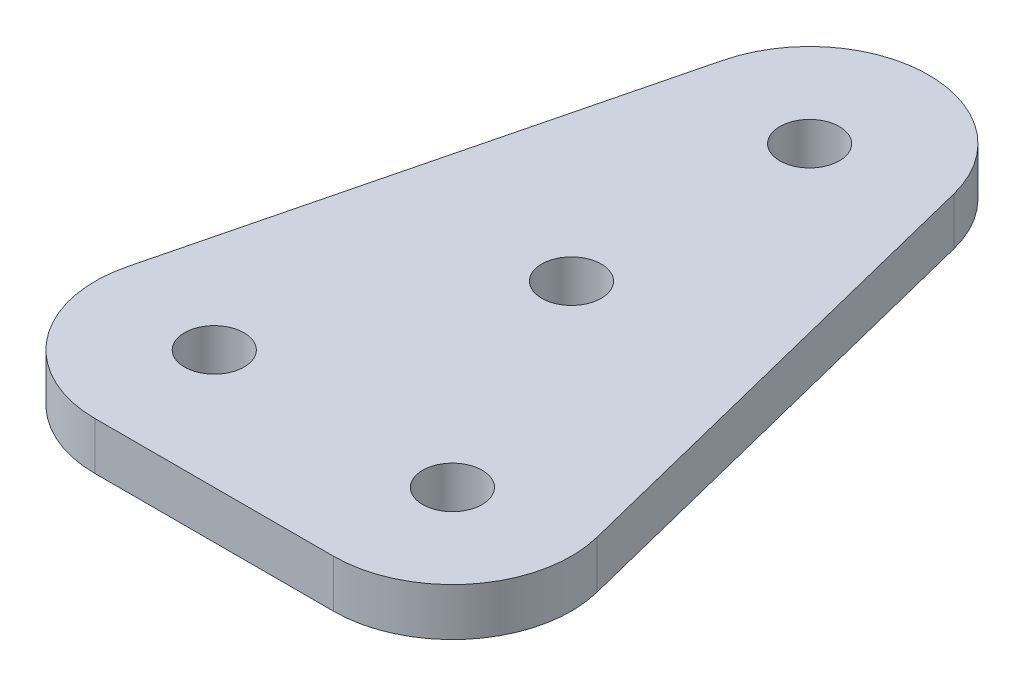
from build123d import *

# Parameters (mm, degrees)
SKETCH1_R           = 2.5
BOSS_EXTRUDE1_DEPTH = 4


with BuildPart() as part:
    # Sketch1 → Boss-Extrude1 (new body)
    with BuildSketch(Plane(origin=(0, 0, 0), x_dir=(1, 0, 0), z_dir=(0, 1, 0))):
        with BuildLine():
            Line((-9.701425001, 42.42535625), (-19.701425001, 2.42535625))
            ThreePointArc((-19.701425001, 2.42535625), (-17.88205438, -6.154122094), (-10, -10))
            Line((-10, -10), (10, -10))
            ThreePointArc((10, -10), (17.88205438, -6.154122094), (19.701425001, 2.42535625))
            Line((19.701425001, 2.42535625), (9.701425001, 42.42535625))
            ThreePointArc((9.701425001, 42.42535625), (0, 50), (-9.701425001, 42.42535625))
        make_face()
        with Locations(Location((10, 0, 0), (0, 0, 270))):
            Circle(SKETCH1_R, mode=Mode.SUBTRACT)
        with Locations(Location((-10, 0, 0), (0, 0, 90))):
            Circle(SKETCH1_R, mode=Mode.SUBTRACT)
        with Locations(Location((0, 20, 0), (0, 0, 270))):
            Circle(SKETCH1_R, mode=Mode.SUBTRACT)
        with Locations(Location((0, 40, 0), (0, 0, 270))):
            Circle(SKETCH1_R, mode=Mode.SUBTRACT)
    extrude(amount=BOSS_EXTRUDE1_DEPTH)


solid = part.part
